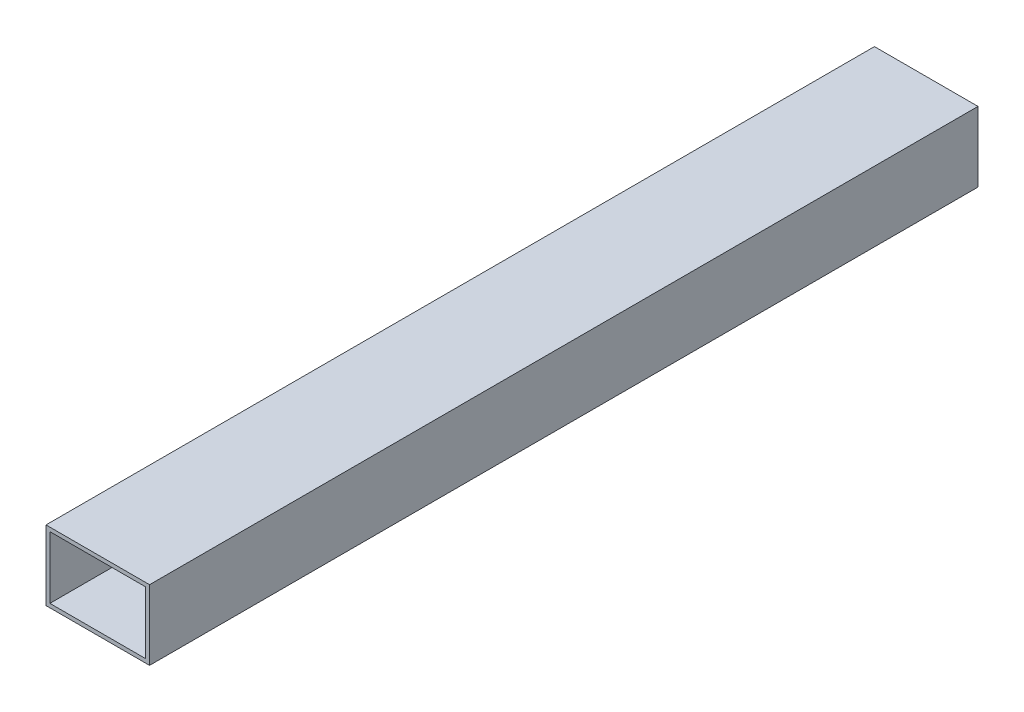
from build123d import *

# Parameters (mm, degrees)
ESQUISSE1_W        = 40
ESQUISSE1_H        = 27
ESQUISSE1_W_2      = 37
ESQUISSE1_H_2      = 24
BOSS_EXTRU_1_DEPTH = 320


with BuildPart() as part:
    # Esquisse1 → Boss.-Extru.1 (new body)
    with BuildSketch(Plane.XY):
        with Locations((20, 13.5)):
            Rectangle(ESQUISSE1_W, ESQUISSE1_H)
        with Locations((20, 13.5)):
            Rectangle(ESQUISSE1_W_2, ESQUISSE1_H_2, mode=Mode.SUBTRACT)
    extrude(amount=BOSS_EXTRU_1_DEPTH)


solid = part.part
